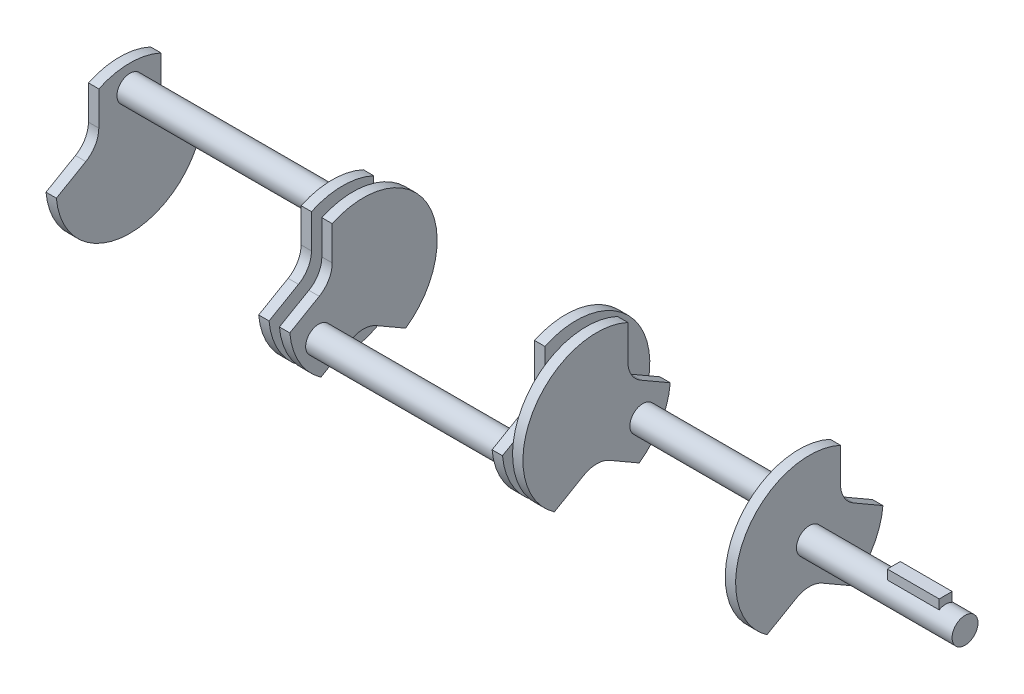
from build123d import *

# Parameters (mm, degrees)
BOSS_EXTRUDE2_DEPTH      = 5.08
BODY_MOVE_COPY13_ANGLE   = 120
BODY_MOVE_COPY18_ANGLE   = 120
BOSS_EXTRUDE3_REACH      = 338.644
SKETCH8_R                = 6.35
BOSS_EXTRUDE4_REACH      = 236.246
SKETCH9_R                = 12.7
BOSS_EXTRUDE5_REACH      = 226.342
SKETCH11_R               = 6.35
BOSS_EXTRUDE6_REACH      = 241.206
SKETCH13_R               = 6.35
SKETCH14_R               = 6.35
BOSS_EXTRUDE7_DEPTH      = 76.2
BOSS_EXTRUDE8_REACH      = 420.167
BOSS_EXTRUDE8_END_RADIUS = 6.35
SKETCH15_W               = 25.4
SKETCH15_H               = 6.35


with BuildPart() as part:
    # Sketch5 → Boss-Extrude2 (new body)
    with BuildSketch(Plane(origin=(0, 0, 0), x_dir=(0, 0, -1), z_dir=(1, 0, 0))):
        with BuildLine():
            Line((15.24, 32.778024856), (15.24, 16.131166521))
            ThreePointArc((15.24, 16.131166521), (16.941477372, 9.781166521), (21.59, 5.132643893))
            Line((21.59, 5.132643893), (36.006602211, -3.190785274))
            ThreePointArc((36.006602211, -3.190785274), (0, -36.147704125), (-36.006602211, -3.190785274))
            Line((-36.006602211, -3.190785274), (-21.59, 5.132643893))
            ThreePointArc((-21.59, 5.132643893), (-16.941477372, 9.781166521), (-15.24, 16.131166521))
            Line((-15.24, 16.131166521), (-15.24, 32.778024856))
            ThreePointArc((-15.24, 32.778024856), (0, 36.147704125), (15.24, 32.778024856))
        make_face()
    extrude(amount=BOSS_EXTRUDE2_DEPTH)


with BuildPart() as body_2:
    # Body-Move/Copy11: copy of part
    add(part.part.moved(Location((104.14, 0, 0))))


with BuildPart() as body_3:
    # Body-Move/Copy12: copy of body 2
    add(body_2.part.moved(Location((10.16, 0, 0))))


with BuildPart() as body_3_1:
    # Body-Move/Copy13: moved
    add(body_3.part.rotate(Axis((0, 0, 0), (1, 0, 0)), BODY_MOVE_COPY13_ANGLE))


with BuildPart() as body_4:
    # Body-Move/Copy14: copy of body 3
    add(body_3_1.part.moved(Location((104.14, 0, 0))))


with BuildPart() as body_5:
    # Body-Move/Copy16: copy of body 4
    add(body_4.part.moved(Location((10.16, 0, 0))))


with BuildPart() as body_5_1:
    # Body-Move/Copy18: moved
    add(body_5.part.rotate(Axis((0, 0, 0), (1, 0, 0)), BODY_MOVE_COPY18_ANGLE))


with BuildPart() as body_6:
    # Body-Move/Copy19: copy of body 5
    add(body_5_1.part.moved(Location((104.14, 0, 0))))

    # Sketch13 → Boss-Extrude6 (add, up to next)
    with BuildSketch(Plane(origin=(233.68, 0, 0), x_dir=(0, 0, -1), z_dir=(1, 0, 0)), mode=Mode.PRIVATE) as boss_extrude6_sk1:
        with Locations(Location((22.574940501, -11.6418238, 0), (0, 0, 180))):
            Circle(SKETCH13_R)
    boss_extrude6_tool1 = extrude(boss_extrude6_sk1.sketch, amount=BOSS_EXTRUDE6_REACH, mode=Mode.PRIVATE) - body_6.part

    add(body_5_1.part)  # Boss-Extrude6 merges body 5
    add(boss_extrude6_tool1.solids().sort_by_distance((233.68, -11.641824, -22.574941))[0])

    # Sketch14 → Boss-Extrude7 (add)
    with BuildSketch(Plane(origin=(337.82, 0, 0), x_dir=(0, 0, -1), z_dir=(1, 0, 0))):
        with Locations(Location((0, 0, 0), (0, 0, 180))):
            Circle(SKETCH14_R)
    extrude(amount=BOSS_EXTRUDE7_DEPTH)

    # Boss-Extrude8: up to this cylinder (the profile starts outside it)
    boss_extrude8_end = Plane(origin=(391.843814, 0, 0), z_dir=(-1, 0, 0)) * Cylinder(BOSS_EXTRUDE8_END_RADIUS, 854.034, mode=Mode.PRIVATE)
    # Sketch15 → Boss-Extrude8 (add, up to the surface)
    with BuildSketch(Plane(origin=(0, 10.16, 0), x_dir=(1, 0, 0), z_dir=(0, 1, 0)), mode=Mode.PRIVATE) as boss_extrude8_sk1:
        with Locations((391.843813574, 0)):
            Rectangle(SKETCH15_W, SKETCH15_H)
    boss_extrude8_tool1 = extrude(boss_extrude8_sk1.sketch, amount=-BOSS_EXTRUDE8_REACH, mode=Mode.PRIVATE) - boss_extrude8_end
    add(boss_extrude8_tool1.solids().sort_by_distance((391.843814, 10.16, 0))[0])


with BuildPart() as body_2_1:
    add(body_2.part)

    # Sketch8 → Boss-Extrude3 (add, up to next)
    with BuildSketch(Plane(origin=(5.08, 0, 0), x_dir=(0, 0, -1), z_dir=(1, 0, 0)), mode=Mode.PRIVATE) as boss_extrude3_sk1:
        with Locations(Location((0, 25.4, 0), (0, 0, 180))):
            Circle(SKETCH8_R)
    boss_extrude3_tool1 = extrude(boss_extrude3_sk1.sketch, amount=BOSS_EXTRUDE3_REACH, mode=Mode.PRIVATE) - body_2_1.part

    add(part.part)  # Boss-Extrude3 merges part
    add(boss_extrude3_tool1.solids().sort_by_distance((5.08, 25.4, 0))[0])


with BuildPart() as body_3_2:
    add(body_3_1.part)

    # Sketch9 → Boss-Extrude4 (add, up to next)
    with BuildSketch(Plane(origin=(109.22, 0, 0), x_dir=(0, 0, -1), z_dir=(1, 0, 0)), mode=Mode.PRIVATE) as boss_extrude4_sk1:
        with Locations(Location((0, 0, 0), (0, 0, 180))):
            Circle(SKETCH9_R)
    boss_extrude4_tool1 = extrude(boss_extrude4_sk1.sketch, amount=BOSS_EXTRUDE4_REACH, mode=Mode.PRIVATE) - body_3_2.part

    add(body_2_1.part)  # Boss-Extrude4 merges body 2
    add(boss_extrude4_tool1.solids().sort_by_distance((109.22, 0, 0))[0])


with BuildPart() as body_4_1:
    add(body_4.part)

    # Sketch11 → Boss-Extrude5 (add, up to next)
    with BuildSketch(Plane(origin=(119.38, 0, 0), x_dir=(0, 0, -1), z_dir=(1, 0, 0)), mode=Mode.PRIVATE) as boss_extrude5_sk1:
        with Locations(Location((-21.889975743, -12.883670361, 0), (0, 0, 180))):
            Circle(SKETCH11_R)
    boss_extrude5_tool1 = extrude(boss_extrude5_sk1.sketch, amount=BOSS_EXTRUDE5_REACH, mode=Mode.PRIVATE) - body_4_1.part

    add(body_3_2.part)  # Boss-Extrude5 merges body 3
    add(boss_extrude5_tool1.solids().sort_by_distance((119.38, -12.88367, 21.889976))[0])


solid = Compound([body_6.part, body_4_1.part])
